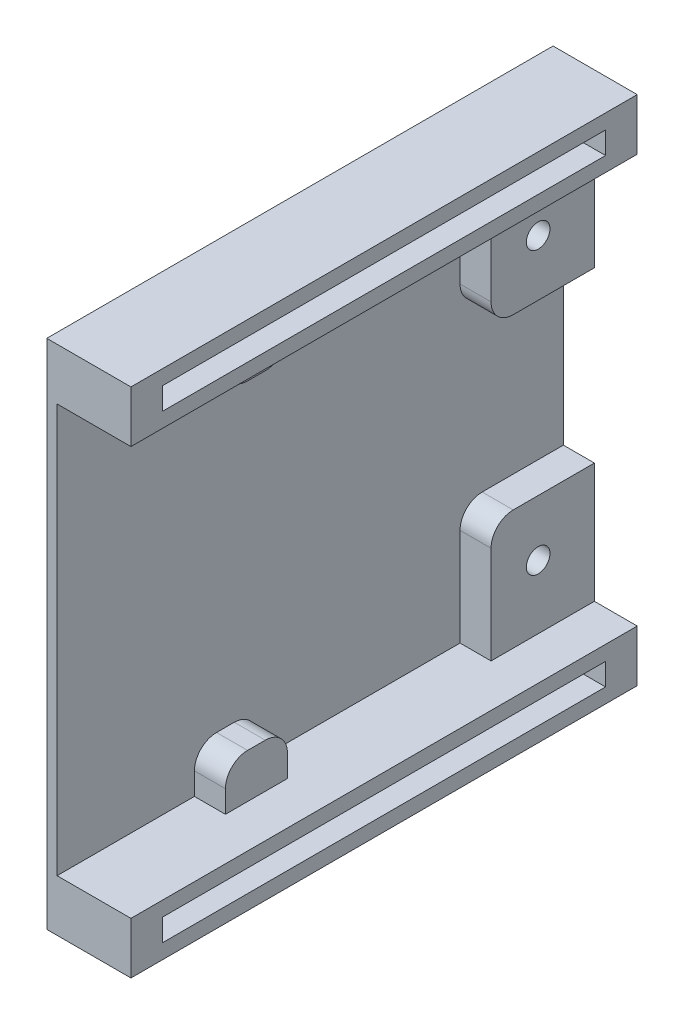
from build123d import *

# Parameters (mm, degrees)
SKETCH1_W               = 34.67
SKETCH1_H               = 34.29
BOSS_EXTRUDE1_DEPTH     = 1
SKETCH3_W               = 3.5
SKETCH3_H               = 34.29
BOSS_EXTRUDE2_DEPTH     = 5
CUT_EXTRUDE1_DEPTH      = 26.108828129
CUT_EXTRUDE1_DEPTH_BACK = 26.108828129
SKETCH5_W               = 1.5
SKETCH5_H               = 30
SKETCH6_W               = 3
SKETCH6_H               = 4.2
SKETCH6_W_2             = 8.11
SKETCH6_H_2             = 7
BOSS_EXTRUDE3_DEPTH     = 2.1
FILLET1_R               = 1.5
CUT_EXTRUDE2_DEPTH      = 25.577698224
CUT_EXTRUDE2_DEPTH_BACK = 25.577698224
SKETCH7_R               = 0.8
CHAMFER1_SIZE           = 0.3


with BuildPart() as part:
    # Sketch1 → Boss-Extrude1 (new body)
    with BuildSketch(Plane.YZ):
        Rectangle(SKETCH1_W, SKETCH1_H)
    extrude(amount=BOSS_EXTRUDE1_DEPTH)

    # Sketch3 → Boss-Extrude2 (add)
    with BuildSketch(Plane.YZ.offset(1)):
        with Locations((-15.585, 0)):
            Rectangle(SKETCH3_W, SKETCH3_H)
        with Locations((15.585, 0)):
            Rectangle(SKETCH3_W, SKETCH3_H)
    extrude(amount=BOSS_EXTRUDE2_DEPTH)

    # Sketch5 → Cut-Extrude1 (cut, two sides: drawn at the far end of the back side and taken through both)
    with BuildSketch(Plane.YZ.offset(6).offset(-CUT_EXTRUDE1_DEPTH_BACK)):
        with Locations((-15.585, 0)):
            Rectangle(SKETCH5_W, SKETCH5_H)
        with Locations((15.585, 0)):
            Rectangle(SKETCH5_W, SKETCH5_H)
    extrude(amount=CUT_EXTRUDE1_DEPTH + CUT_EXTRUDE1_DEPTH_BACK, mode=Mode.SUBTRACT)

    # Sketch6 → Boss-Extrude3 (add)
    with BuildSketch(Plane.YZ.offset(1)):
        with Locations((-12.335, 5.745)):
            Rectangle(SKETCH6_W, SKETCH6_H)
        with Locations((-9.78, -13.645)):
            Rectangle(SKETCH6_W_2, SKETCH6_H_2)
        with Locations((9.78, -13.645)):
            Rectangle(SKETCH6_W_2, SKETCH6_H_2)
        with Locations((12.335, 5.745)):
            Rectangle(SKETCH6_W, SKETCH6_H)
    extrude(amount=BOSS_EXTRUDE3_DEPTH)

    # Fillet1
    fillet1_edges = [part.edges().sort_by_distance(p)[0] for p in [
        (2.05, 5.725, -10.145),
        (2.05, -5.725, -10.145),
        (2.05, -10.835, 3.645),
        (2.05, -10.835, 7.845),
        (2.05, 10.835, 7.845),
        (2.05, 10.835, 3.645),
    ]]
    fillet(fillet1_edges, radius=FILLET1_R)

    # Sketch7 → Cut-Extrude2 (cut, two sides: drawn at the far end of the back side and taken through both)
    with BuildSketch(Plane.YZ.offset(3.1).offset(-CUT_EXTRUDE2_DEPTH_BACK)):
        with Locations(Location((-9.525, -13.335, 0), (0, 0, 270))):
            Circle(SKETCH7_R)
        with Locations(Location((9.525, -13.335, 0), (0, 0, 270))):
            Circle(SKETCH7_R)
    extrude(amount=CUT_EXTRUDE2_DEPTH + CUT_EXTRUDE2_DEPTH_BACK, mode=Mode.SUBTRACT)

    # Chamfer1
    chamfer1_edges = [part.edges().sort_by_distance(p)[0] for p in [
        (0, -9.525, -12.535),
        (0, 9.525, -12.535),
        (0, 0, -17.145),
        (0, -17.335, 0),
        (0, -14.835, 0),
        (0, -15.585, -15),
        (0, -16.335, 0),
        (0, -15.585, 15),
        (0, 0, 17.145),
        (0, 16.335, 0),
        (0, 15.585, -15),
        (0, 14.835, 0),
        (0, 17.335, 0),
        (0, 15.585, 15),
    ]]
    chamfer(chamfer1_edges, length=CHAMFER1_SIZE)


solid = part.part
